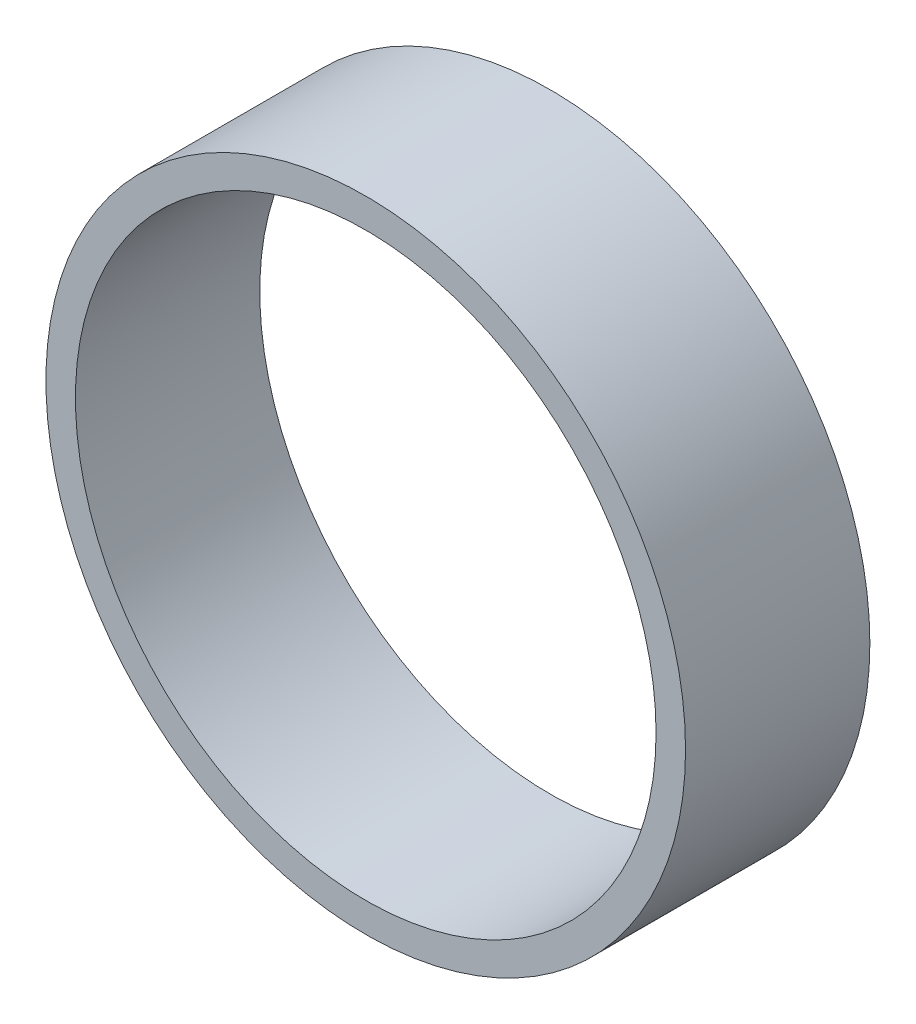
from build123d import *

# Parameters (mm, degrees)
SKETCH1_R           = 34.7
SKETCH1_R_2         = 31.5
BOTTLE_COLLAR_DEPTH = 20


with BuildPart() as part:
    # Sketch1 → Bottle_collar (new body)
    with BuildSketch(Plane.XY):
        Circle(SKETCH1_R)
        Circle(SKETCH1_R_2, mode=Mode.SUBTRACT)
    extrude(amount=BOTTLE_COLLAR_DEPTH)


solid = part.part
